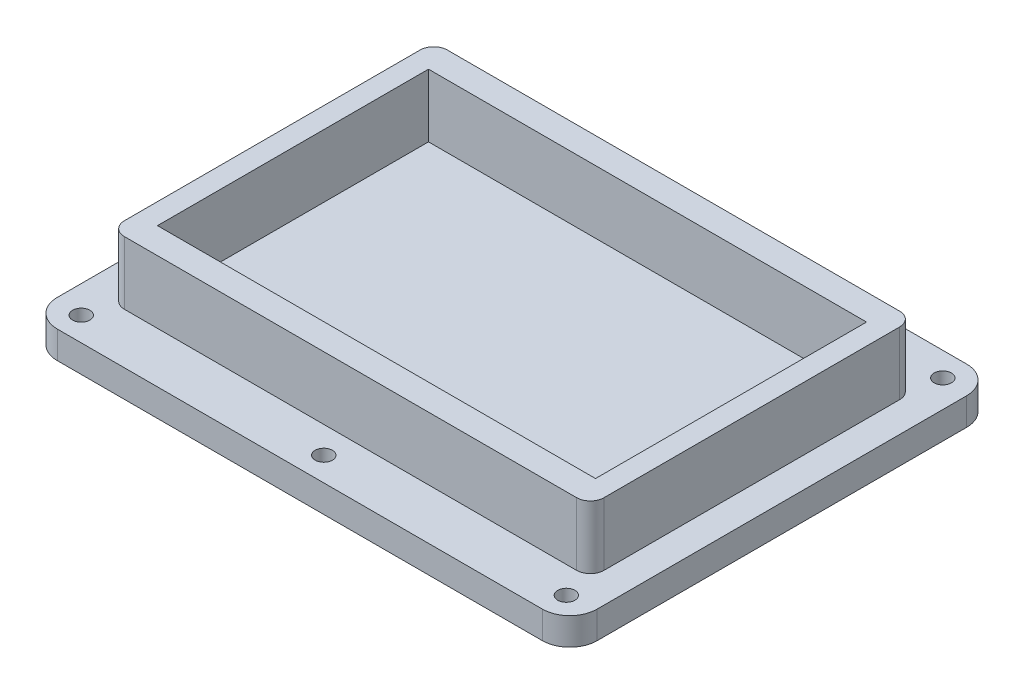
from build123d import *

# Parameters (mm, degrees)
SKETCH1_W                  = 50.0888
SKETCH1_H                  = 39.37
BOSS_EXTRUDE1_DEPTH        = 2.54
SKETCH2_W                  = 44.5008
SKETCH2_H                  = 29.972
BOSS_EXTRUDE2_DEPTH        = 5.842
FILLET1_R                  = 2.54
FILLET2_R                  = 1.27
F_1_6_1_6_DIAMETER_HOLE1_D = 1.6
SKETCH5_W                  = 40.64
SKETCH5_H                  = 25.146
CUT_EXTRUDE1_DEPTH         = 5.842


with BuildPart() as part:
    # Sketch1 → Boss-Extrude1 (new body)
    with BuildSketch(Plane(origin=(0, 0, 0), x_dir=(1, 0, 0), z_dir=(0, 1, 0))):
        with Locations((-39.815086883, 34.57343553)):
            Rectangle(SKETCH1_W, SKETCH1_H)
    extrude(amount=BOSS_EXTRUDE1_DEPTH)

    # Sketch2 → Boss-Extrude2 (add)
    with BuildSketch(Plane(origin=(0, 2.54, 0), x_dir=(1, 0, 0), z_dir=(0, 1, 0))):
        with Locations((-39.815086883, 34.57343553)):
            Rectangle(SKETCH2_W, SKETCH2_H)
    extrude(amount=BOSS_EXTRUDE2_DEPTH)

    # Fillet1
    fillet1_edges = [part.edges().sort_by_distance(p)[0] for p in [
        (-64.859486883, 1.27, -54.25843553),
        (-14.770686883, 1.27, -54.25843553),
        (-14.770686883, 1.27, -14.88843553),
        (-64.859486883, 1.27, -14.88843553),
    ]]
    fillet(fillet1_edges, radius=FILLET1_R)

    # Fillet2
    fillet2_edges = [part.edges().sort_by_distance(p)[0] for p in [
        (-62.065486883, 5.461, -49.55943553),
        (-62.065486883, 5.461, -19.58743553),
        (-17.564686883, 5.461, -19.58743553),
        (-17.564686883, 5.461, -49.55943553),
    ]]
    fillet(fillet2_edges, radius=FILLET2_R)

    # Ø1.6 (1.6) Diameter Hole1 (through all)
    with Locations(Plane(origin=(0, 0, 0), x_dir=(-1, 0, 0), z_dir=(0, -1, 0))):
        with Locations((62.319486883, 17.11093553), (39.815086883, 17.11093553), (17.310686883, 17.11093553), (17.310686883, 52.03593553), (39.815086883, 52.03593553), (62.319486883, 52.03593553)):
            Hole(F_1_6_1_6_DIAMETER_HOLE1_D / 2)

    # Sketch5 → Cut-Extrude1 (cut)
    with BuildSketch(Plane(origin=(0, 8.382, 0), x_dir=(1, 0, 0), z_dir=(0, 1, 0))):
        with Locations((-39.815086883, 34.57343553)):
            Rectangle(SKETCH5_W, SKETCH5_H)
    extrude(amount=-CUT_EXTRUDE1_DEPTH, mode=Mode.SUBTRACT)


solid = part.part
